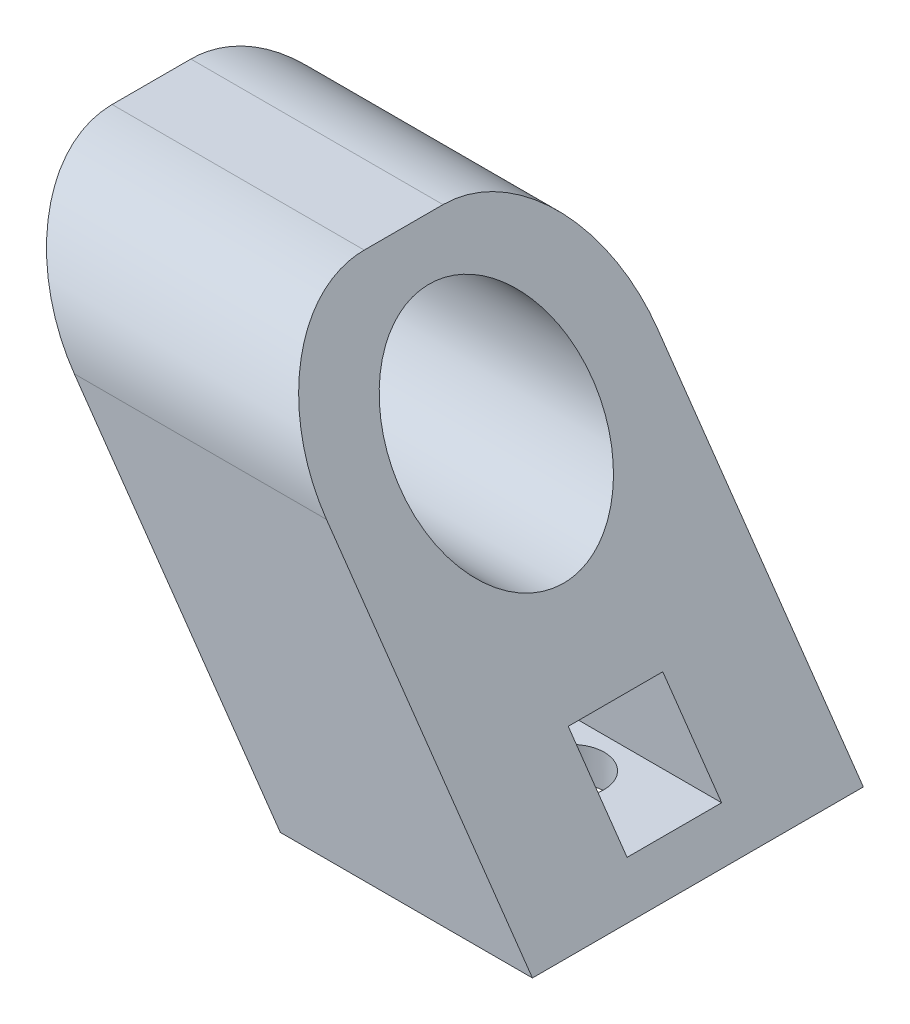
from build123d import *

# Parameters (mm, degrees)
BOSS_EXTRUDE1_DEPTH     = 25
FILLET1_R               = 19.05
CUT_EXTRUDE1_DEPTH      = 74.437759365
CUT_EXTRUDE1_DEPTH_BACK = 74.437759365
SKETCH3_R               = 14.5
SKETCH3_W               = 14.2875
SKETCH3_H               = 12.7
SKETCH5_R               = 4.8895
CUT_EXTRUDE2_DEPTH      = 12.7


with BuildPart() as part:
    # Sketch2 → Boss-Extrude1 (new, symmetric)
    with BuildSketch(Plane.XY):
        Polygon((-28.936184536, 20), (15.526994141, -43.5), (53.626994141, -43.5), (9.163815464, 20), align=None)
    extrude(amount=BOSS_EXTRUDE1_DEPTH, both=True)

    # Fillet1
    fillet1_edges = [part.edges().sort_by_distance(p)[0] for p in [
        (-9.886184536, 20, 25),
        (-9.886184536, 20, -25),
    ]]
    fillet(fillet1_edges, radius=FILLET1_R)

    # Sketch3 → Cut-Extrude1 (cut, two sides: drawn at the far end of the back side and taken through both)
    with BuildSketch(Plane(origin=(0, 0, 0), x_dir=(0, 0, -1), z_dir=(1, 0, 0)).offset(-CUT_EXTRUDE1_DEPTH_BACK)):
        with Locations(Location((0, 0, 0), (0, 0, 270))):
            Circle(SKETCH3_R)
        with Locations((0, -32.07)):
            Rectangle(SKETCH3_W, SKETCH3_H)
    extrude(amount=CUT_EXTRUDE1_DEPTH + CUT_EXTRUDE1_DEPTH_BACK, mode=Mode.SUBTRACT)

    # Sketch5 → Cut-Extrude2 (cut)
    with BuildSketch(Plane.XZ.offset(43.5)):
        with Locations((34.576994141, 0)):
            Circle(SKETCH5_R)
    extrude(amount=-CUT_EXTRUDE2_DEPTH, mode=Mode.SUBTRACT)


solid = part.part
